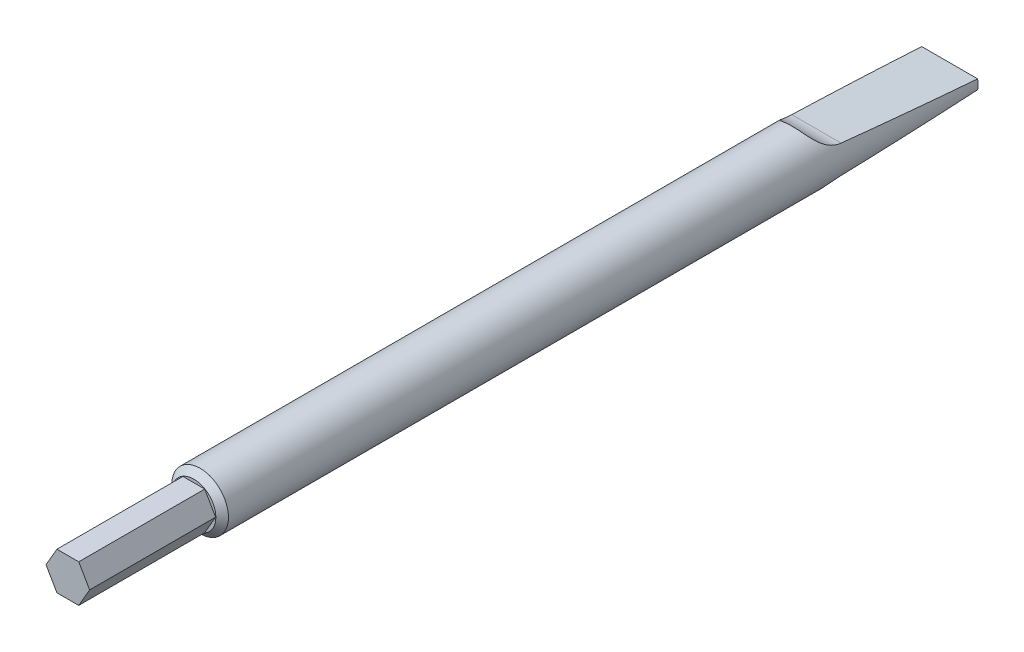
from build123d import *

# Parameters (mm, degrees)
SKETCH2_R           = 4.5
BOSS_EXTRUDE1_DEPTH = 140
CUT_EXTRUDE1_DEPTH  = 4.5
CUT_EXTRUDE3_START  = 120
SKETCH4_R           = 4.5
CUT_EXTRUDE3_DEPTH  = 20
CHAMFER2_SIZE       = 1


with BuildPart() as part:
    # Sketch2 → Boss-Extrude1 (new body)
    with BuildSketch(Plane(origin=(0, 0, 0), x_dir=(0, 1, 0), z_dir=(0, 0, 1))):
        with Locations(Location((0, 0, 0), (0, 0, 270))):
            Circle(SKETCH2_R)
    extrude(amount=BOSS_EXTRUDE1_DEPTH)

    # Sketch3 → Cut-Extrude1 (cut, symmetric)
    with BuildSketch(Plane.YZ):
        with BuildLine():
            Line((-2.229044758, 21.151325457), (-0.75, 0))
            Line((-0.75, 0), (-4.5, 0))
            Line((-4.5, 0), (-4.5, 25))
            ThreePointArc((-4.5, 25), (-2.910634909, 23.343484317), (-2.229044758, 21.151325457))
        make_face()
        with BuildLine():
            Line((2.229044758, 21.151325457), (0.75, 0))
            Line((0.75, 0), (4.5, 0))
            Line((4.5, 0), (4.5, 25))
            ThreePointArc((4.5, 25), (2.910634909, 23.343484317), (2.229044758, 21.151325457))
        make_face()
    extrude(amount=CUT_EXTRUDE1_DEPTH, both=True, mode=Mode.SUBTRACT)

    # Sketch4 → Cut-Extrude3 (cut)
    with BuildSketch(Plane(origin=(0, 0, 0), x_dir=(0, 1, 0), z_dir=(0, 0, 1)).offset(CUT_EXTRUDE3_START)):
        with Locations(Location((0, 0, 0), (0, 0, 99.594068227))):
            Circle(SKETCH4_R)
        Polygon((-3, 1.732050808), (-3, -1.732050808), (0, -3.464101615), (3, -1.732050808), (3, 1.732050808), (0, 3.464101615), align=None, mode=Mode.SUBTRACT)
    extrude(amount=CUT_EXTRUDE3_DEPTH, mode=Mode.SUBTRACT)

    # Chamfer2
    chamfer2_edges = [part.edges().sort_by_distance(p)[0] for p in [
        (-4.5, 0, 120),
    ]]
    chamfer(chamfer2_edges, length=CHAMFER2_SIZE)


solid = part.part
